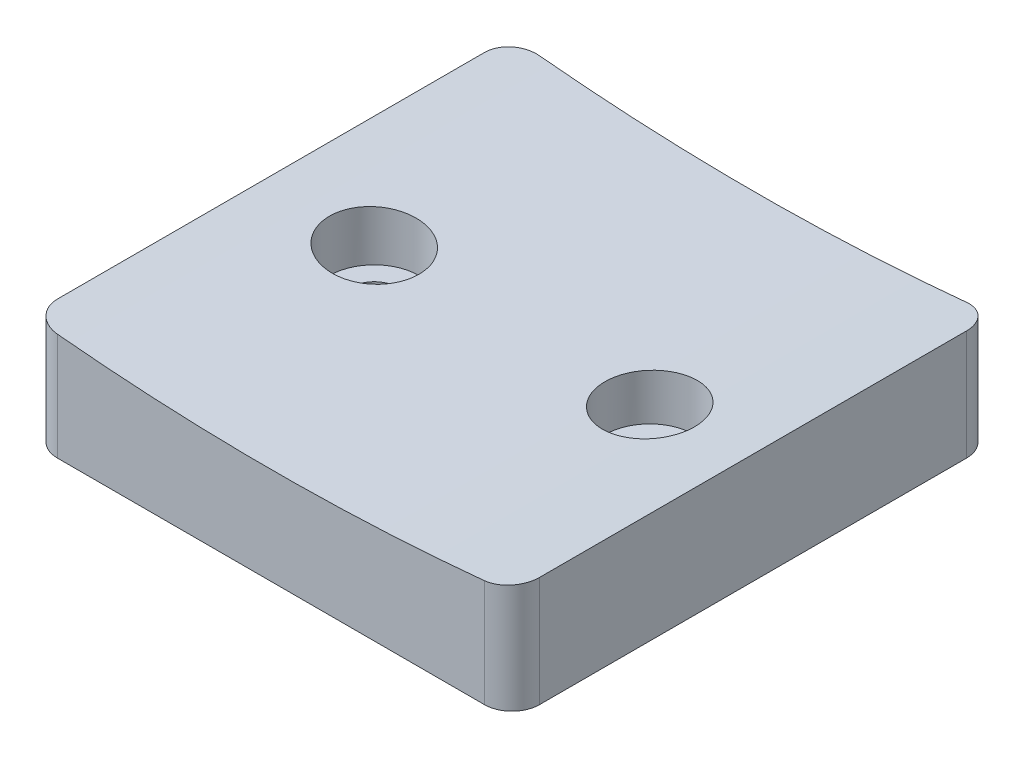
from build123d import *

# Parameters (mm, degrees)
SKETCH_2_R               = 1.75
EXTRUDE_1_DEPTH          = 8
CUT_EXTRUDE_1_DEPTH      = 40.940580867
CUT_EXTRUDE_1_DEPTH_BACK = 40.940580867
CUT_EXTRUDE_2_DEPTH      = 3.5
CUT_EXTRUDE_2_DEPTH_BACK = 3.5
SKETCH_6_R               = 3.25


with BuildPart() as part:
    # Эскиз2 → Бобышка-Вытянуть1 (new body)
    with BuildSketch(Plane(origin=(0, 0, 0), x_dir=(-1, 0, 0), z_dir=(0, 1, 0))):
        with BuildLine():
            Line((5, -17.5), (-5, -17.5))
            Line((-5, -17.5), (-15.5, -17.5))
            ThreePointArc((-15.5, -17.5), (-16.914213562, -16.914213562), (-17.5, -15.5))
            Line((-17.5, -15.5), (-17.5, 15.5))
            ThreePointArc((-17.5, 15.5), (-16.914213562, 16.914213562), (-15.5, 17.5))
            Line((-15.5, 17.5), (-5, 17.5))
            Line((-5, 17.5), (5, 17.5))
            Line((5, 17.5), (15.5, 17.5))
            ThreePointArc((15.5, 17.5), (16.914213562, 16.914213562), (17.5, 15.5))
            Line((17.5, 15.5), (17.5, -15.5))
            ThreePointArc((17.5, -15.5), (16.914213562, -16.914213562), (15.5, -17.5))
            Line((15.5, -17.5), (5, -17.5))
        make_face()
        with Locations((10, 0)):
            Circle(SKETCH_2_R, mode=Mode.SUBTRACT)
        with Locations((-10, 0)):
            Circle(SKETCH_2_R, mode=Mode.SUBTRACT)
    extrude(amount=EXTRUDE_1_DEPTH)

    # Эскиз4 → Вырез-Вытянуть1 (cut, two sides: drawn at the far end of the back side and taken through both)
    with BuildSketch(Plane.XY.offset(17.5).offset(-CUT_EXTRUDE_1_DEPTH_BACK)):
        with BuildLine():
            Line((-98.814506181, 16.947453844), (-17.5, 8))
            ThreePointArc((-17.5, 8), (0, 7.040089286), (17.5, 8))
            Line((17.5, 8), (98.814506181, 16.947453844))
            Line((98.814506181, 16.947453844), (98.814506181, 180.558038412))
            Line((98.814506181, 180.558038412), (-98.814506181, 180.558038412))
            Line((-98.814506181, 180.558038412), (-98.814506181, 16.947453844))
        make_face()
    extrude(amount=CUT_EXTRUDE_1_DEPTH + CUT_EXTRUDE_1_DEPTH_BACK, mode=Mode.SUBTRACT)

    # Эскиз6 → Вырез-Вытянуть2 (cut, two sides: drawn at the far end of the back side and taken through both)
    with BuildSketch(Plane(origin=(0, 7.352932668, 0), x_dir=(-1, 0, 0), z_dir=(0, -1, 0)).offset(-CUT_EXTRUDE_2_DEPTH_BACK)):
        with Locations((10, 0)):
            Circle(SKETCH_6_R)
        with Locations((-10, 0)):
            Circle(SKETCH_6_R)
    extrude(amount=CUT_EXTRUDE_2_DEPTH + CUT_EXTRUDE_2_DEPTH_BACK, mode=Mode.SUBTRACT)


solid = part.part
